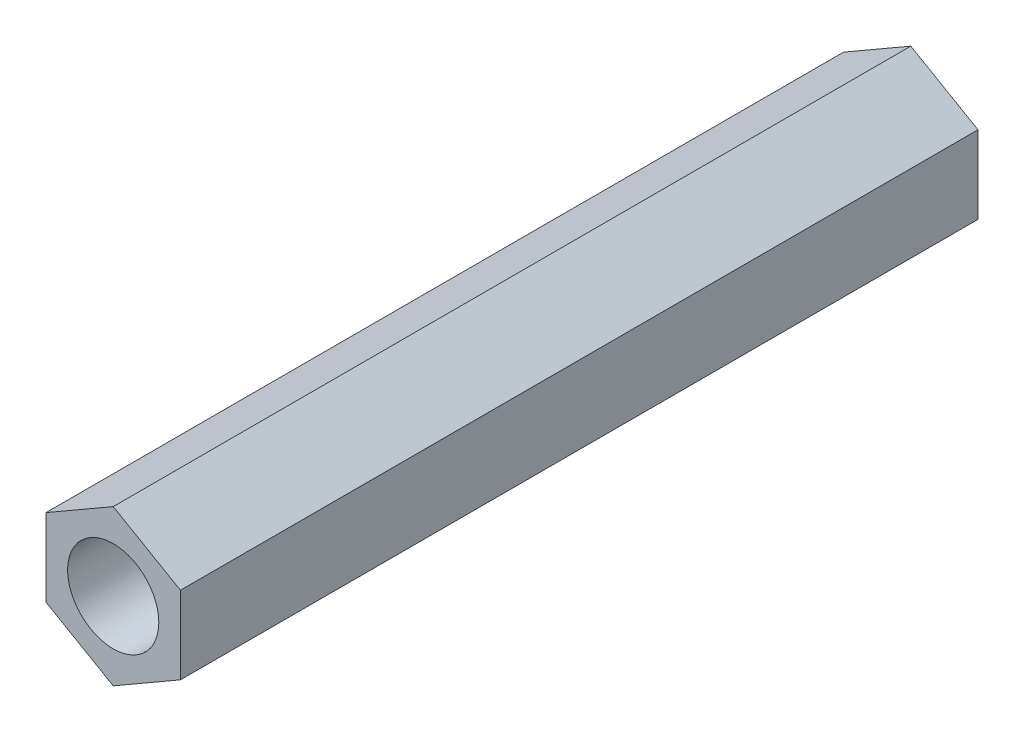
from build123d import *

# Parameters (mm, degrees)
SKETCH_1_R      = 2
EXTRUDE_1_DEPTH = 35


with BuildPart() as part:
    # 草图1 → 凸台-拉伸1 (new body)
    with BuildSketch(Plane.XY):
        Polygon((2.95, -1.703183294), (2.95, 1.703183294), (0, 3.406366588), (-2.95, 1.703183294), (-2.95, -1.703183294), (0, -3.406366588), align=None)
        Circle(SKETCH_1_R, mode=Mode.SUBTRACT)
    extrude(amount=EXTRUDE_1_DEPTH)


solid = part.part
